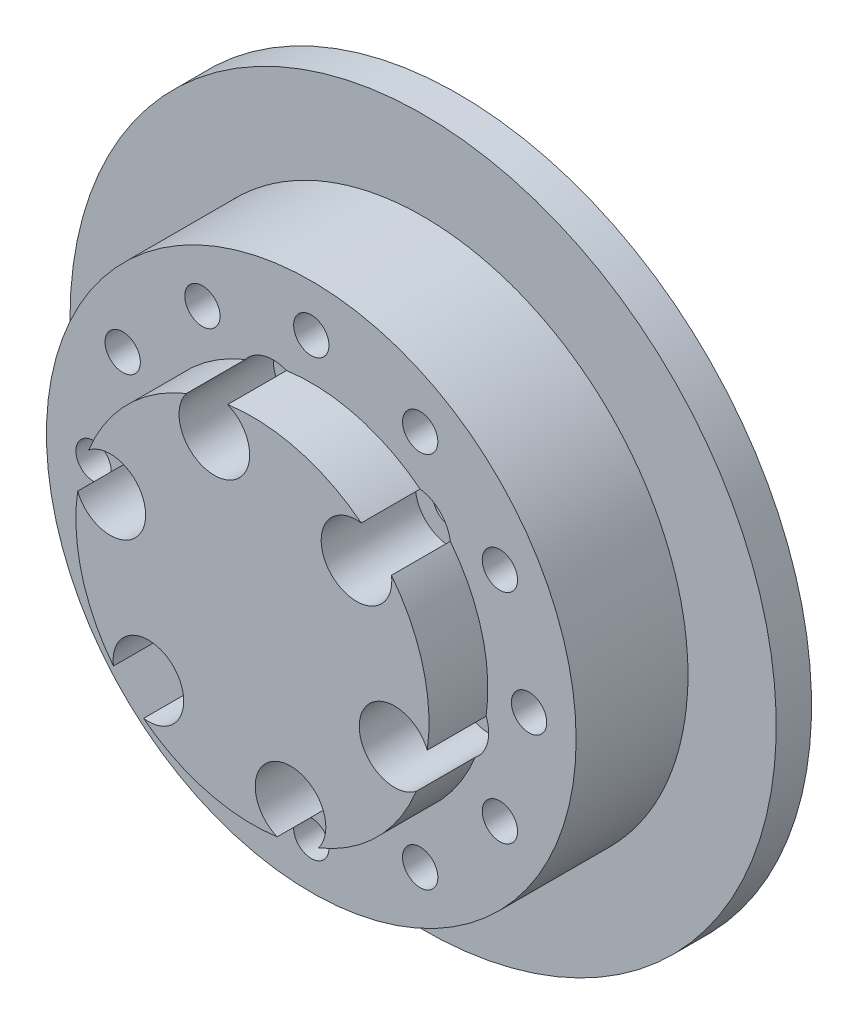
from build123d import *

# Parameters (mm, degrees)
SKETCH_1_R               = 22.5
EXTRUDE_1_DEPTH          = 12.5
SKETCH_2_R               = 15
EXTRUDE_2_DEPTH          = 5
SKETCH_3_R               = 1.5
CUT_EXTRUDE_1_DEPTH      = 5
SKETCH_5_R               = 1.5
CUT_EXTRUDE_2_DEPTH      = 35.186985828
CUT_EXTRUDE_6_DEPTH      = 3
PATTERN_CIRCULAR_1_COUNT = 12
SKETCH_6_R               = 1.5
CUT_EXTRUDE_3_DEPTH      = 37.314597616
SKETCH_7_R               = 3
CUT_EXTRUDE_4_DEPTH      = 8
PATTERN_CIRCULAR_2_COUNT = 6
SKETCH_8_R               = 2
CUT_EXTRUDE_5_DEPTH      = 4
PATTERN_CIRCULAR_3_COUNT = 6
SKETCH_10_R              = 30
SKETCH_10_R_2            = 22.5
EXTRUDE_3_DEPTH          = 3


with BuildPart() as part:
    # 草图1 → 凸台-拉伸1 (new body)
    with BuildSketch(Plane.XY):
        Circle(SKETCH_1_R)
    extrude(amount=EXTRUDE_1_DEPTH)

    # 草图2 → 凸台-拉伸2 (add)
    with BuildSketch(Plane.XY.offset(12.5)):
        Circle(SKETCH_2_R)
    extrude(amount=EXTRUDE_2_DEPTH)

    # 草图3 → 切除-拉伸1 (cut)
    with BuildSketch(Plane.XY.offset(12.5)):
        with Locations((0, 18.5)):
            Circle(SKETCH_3_R)
    cut_extrude_1 = extrude(amount=-CUT_EXTRUDE_1_DEPTH, mode=Mode.SUBTRACT)

    # 草图5 → 切除-拉伸2 (cut, through all)
    with BuildSketch(Plane.XY.offset(12.5)):
        with Locations((0, 18.5)):
            Circle(SKETCH_5_R)
    cut_extrude_2 = extrude(amount=-CUT_EXTRUDE_2_DEPTH, mode=Mode.SUBTRACT)

    # 草图9 → 切除-拉伸6 (cut)
    with BuildSketch(Plane(origin=(0, 0, 0), x_dir=(-1, 0, 0), z_dir=(0, 0, -1))):
        Polygon((1.204492644, 21.438116881), (-1.942237536, 21.012179669), (-3.14673018, 18.074062788), (-1.204492644, 15.561883119), (1.942237536, 15.987820331), (3.14673018, 18.925937212), align=None)
    cut_extrude_6 = extrude(amount=-CUT_EXTRUDE_6_DEPTH, mode=Mode.SUBTRACT)

    # 阵列(圆周)1: 切除-拉伸1, 切除-拉伸2, 切除-拉伸6 ×12 about axis
    pattern_circular_1_axis = Axis((0, 0, 0), (0, 0, 1))
    add([cut_extrude_1.rotate(pattern_circular_1_axis, i * 360 / PATTERN_CIRCULAR_1_COUNT) for i in range(1, PATTERN_CIRCULAR_1_COUNT)], mode=Mode.SUBTRACT)
    add([cut_extrude_2.rotate(pattern_circular_1_axis, i * 360 / PATTERN_CIRCULAR_1_COUNT) for i in range(1, PATTERN_CIRCULAR_1_COUNT)], mode=Mode.SUBTRACT)
    add([cut_extrude_6.rotate(pattern_circular_1_axis, i * 360 / PATTERN_CIRCULAR_1_COUNT) for i in range(1, PATTERN_CIRCULAR_1_COUNT)], mode=Mode.SUBTRACT)

    # 草图6 → 切除-拉伸3 (cut, through all)
    with BuildSketch(Plane(origin=(0, 0, 0), x_dir=(-1, 0, 0), z_dir=(0, 0, -1))):
        with Locations((3.235238064, 12.074072829)):
            Circle(SKETCH_6_R)
    cut_extrude_3 = extrude(amount=-CUT_EXTRUDE_3_DEPTH, mode=Mode.SUBTRACT)

    # 草图7 → 切除-拉伸4 (cut)
    with BuildSketch(Plane.XY.offset(17.5)):
        with Locations((-3.235238064, 12.074072829)):
            Circle(SKETCH_7_R)
    cut_extrude_4 = extrude(amount=-CUT_EXTRUDE_4_DEPTH, mode=Mode.SUBTRACT)

    # 阵列(圆周)2: 切除-拉伸3, 切除-拉伸4 ×6 about axis
    pattern_circular_2_axis = Axis((0, 0, 0), (0, 0, 1))
    add([cut_extrude_3.rotate(pattern_circular_2_axis, i * 360 / PATTERN_CIRCULAR_2_COUNT) for i in range(1, PATTERN_CIRCULAR_2_COUNT)], mode=Mode.SUBTRACT)
    add([cut_extrude_4.rotate(pattern_circular_2_axis, i * 360 / PATTERN_CIRCULAR_2_COUNT) for i in range(1, PATTERN_CIRCULAR_2_COUNT)], mode=Mode.SUBTRACT)

    # 草图8 → 切除-拉伸5 (cut)
    with BuildSketch(Plane(origin=(0, 0, 0), x_dir=(-1, 0, 0), z_dir=(0, 0, -1))):
        with Locations((-2.63995426, 9.852443428)):
            Circle(SKETCH_8_R)
    cut_extrude_5 = extrude(amount=-CUT_EXTRUDE_5_DEPTH, mode=Mode.SUBTRACT)

    # 阵列(圆周)3: 切除-拉伸5 ×6 about axis
    pattern_circular_3_axis = Axis((0, 0, 0), (0, 0, 1))
    for i in range(1, PATTERN_CIRCULAR_3_COUNT):
        add(cut_extrude_5.rotate(pattern_circular_3_axis, i * 360 / PATTERN_CIRCULAR_3_COUNT), mode=Mode.SUBTRACT)


with BuildPart() as body_2:
    # 草图10 → 凸台-拉伸3 (new body)
    with BuildSketch(Plane(origin=(0, 0, 0), x_dir=(-1, 0, 0), z_dir=(0, 0, -1))):
        Circle(SKETCH_10_R)
        Circle(SKETCH_10_R_2, mode=Mode.SUBTRACT)
    extrude(amount=-EXTRUDE_3_DEPTH)


solid = Compound([part.part, body_2.part])
